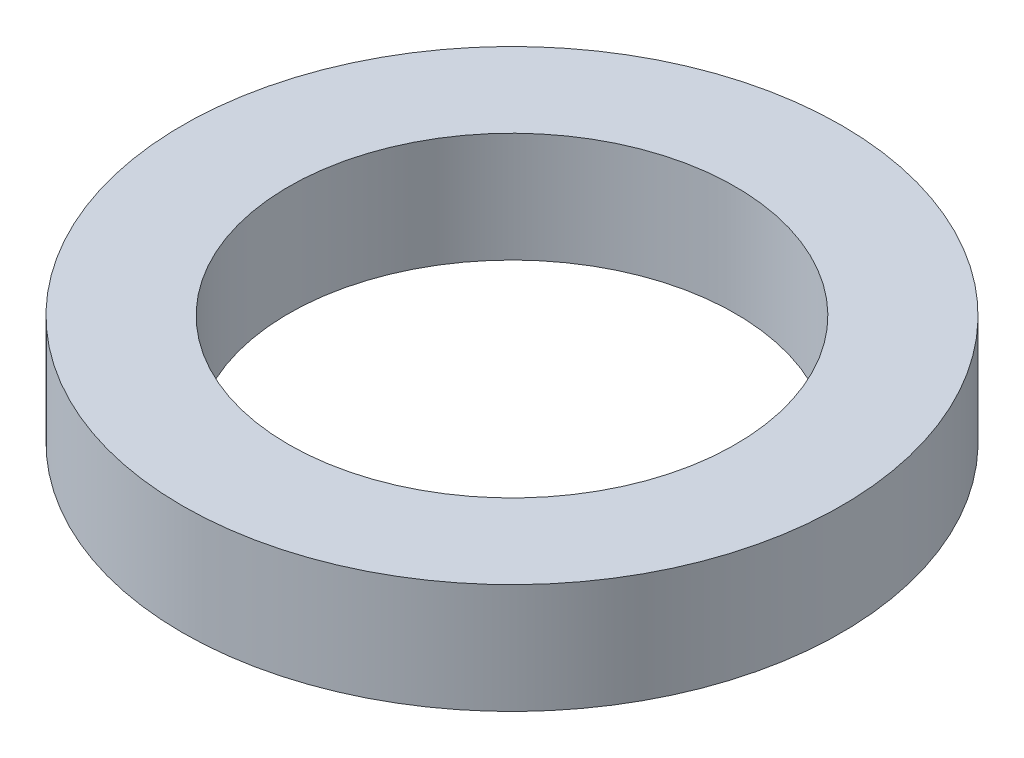
from build123d import *

# Parameters (mm, degrees)
SPACER_STOCK_SKETCH_R           = 9
SPACER_STOCK_DEPTH              = 3
AXLE_RUNNING_CLEARANCE_SKETCH_R = 6.1
AXLE_RUNNING_CLEARANCE_DEPTH    = 3.2


with BuildPart() as part:
    # Spacer stock sketch → Spacer stock (new body)
    with BuildSketch(Plane(origin=(0, -218, 0), x_dir=(1, 0, 0), z_dir=(0, 1, 0))):
        with Locations(Location((-19.009182883, 53.244882879, 0), (0, 0, 270))):
            Circle(SPACER_STOCK_SKETCH_R)
    extrude(amount=SPACER_STOCK_DEPTH)

    # Axle running clearance sketch → Axle running clearance (cut)
    with BuildSketch(Plane(origin=(0, -218.1, 0), x_dir=(1, 0, 0), z_dir=(0, 1, 0))):
        with Locations(Location((-19.009182883, 53.244882879, 0), (0, 0, 270))):
            Circle(AXLE_RUNNING_CLEARANCE_SKETCH_R)
    extrude(amount=AXLE_RUNNING_CLEARANCE_DEPTH, mode=Mode.SUBTRACT)


solid = part.part
